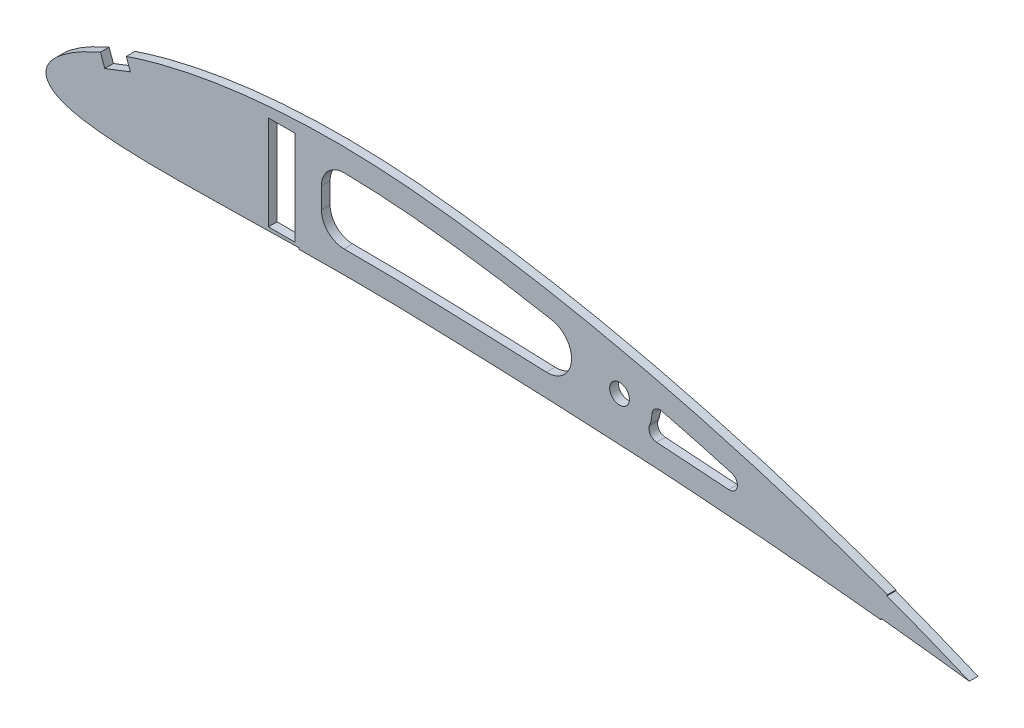
from build123d import *

# Parameters (mm, degrees)
SKETCH1_R           = 3.8862
SKETCH1_W           = 10.414
SKETCH1_H           = 37.132967143
BOSS_EXTRUDE1_DEPTH = 3.4036


with BuildPart() as part:
    # Sketch1 → Boss-Extrude1 (new body)
    with BuildSketch(Plane.XY):
        with BuildLine():
            Line((2548.863805049, 3240.993010404), (2548.870346536, 3240.472643256))
            add(Edge.make_bspline(
                [(2548.870346536, 3240.472643256), (2549.880763048, 3240.485345106), (2552.565327641, 3240.520575205), (2556.947797606, 3240.581451281), (2562.030529235, 3240.583201978), (2567.173828356, 3240.598367485), (2572.377983544, 3240.614063866), (2577.654631688, 3240.581828802), (2582.978163683, 3240.486914125), (2588.350084988, 3240.44098722), (2593.779620592, 3240.256138586), (2599.307416132, 3240.102047018), (2604.908682597, 3239.92347645), (2610.572157053, 3239.771360292), (2616.257225785, 3239.526848933), (2621.969941233, 3239.381379235), (2627.679751972, 3239.150520279), (2633.40209681, 3238.938457036), (2639.136822152, 3238.734443989), (2644.868715349, 3238.4699587), (2650.588345306, 3238.217674209), (2656.296308508, 3237.985536992), (2661.987661359, 3237.664189993), (2667.671808974, 3237.460504991), (2673.311212153, 3237.107925722), (2678.915236244, 3236.799838101), (2684.481545426, 3236.480361793), (2690.011544993, 3236.177968608), (2695.489391996, 3235.832495133), (2700.902150582, 3235.443952361), (2706.254125464, 3235.072976456), (2711.544005033, 3234.699956373), (2716.748448208, 3234.345063592), (2721.876237554, 3233.954236472), (2726.912041029, 3233.50052453), (2731.881695192, 3233.146418869), (2736.757779223, 3232.709631215), (2741.539063821, 3232.320452483), (2746.215557291, 3231.866388618), (2750.770763986, 3231.44101053), (2755.214578157, 3231.018598468), (2759.534567055, 3230.599989202), (2763.74642736, 3230.213242009), (2767.826055945, 3229.747599527), (2771.793322217, 3229.393530966), (2775.151456937, 3228.997383641), (2777.200029602, 3228.800463034), (2777.967751396, 3228.724927698)],
                knots=[19.396955855, 19.396955855, 19.396955855, 19.396955855, 19.516306022, 19.714059236, 19.914611374, 20.116619667, 20.321540433, 20.529276424, 20.739840618, 20.950404813, 21.163744737, 21.381461041, 21.603553869, 21.825646696, 22.050605171, 22.275615756, 22.500574231, 22.725532706, 22.951950418, 23.17832576, 23.403241591, 23.628157423, 23.853040081, 24.076496408, 24.299895492, 24.520374829, 24.739394295, 24.958413761, 25.174498693, 25.387658693, 25.599358693, 25.808138693, 26.013998693, 26.215483983, 26.415525295, 26.611170743, 26.803912863, 26.993735323, 27.177747459, 27.358840435, 27.534095176, 27.704971321, 27.871468943, 28.033634134, 28.189915523, 28.34186779, 28.432980691, 28.432980691, 28.432980691, 28.432980691], degree=3))
            Line((2777.967751396, 3228.724927698), (2778.019298543, 3229.248839689))
            add(Edge.make_bspline(
                [(2778.019298543, 3229.248839689), (2779.174843082, 3229.121826377), (2780.33031454, 3228.992340847), (2787.996855373, 3228.114715942), (2794.540348084, 3227.405765423), (2804.935623835, 3226.12645458), (2808.829276968, 3225.606545428), (2812.811153408, 3225.153500574)],
                knots=[28.432746502, 28.432746502, 28.432746502, 28.432746502, 28.569989508, 28.569989508, 29.343340852, 29.343340852, 29.81381441, 29.81381441, 29.81381441, 29.81381441], degree=3))
            add(Edge.make_bspline(
                [(2812.811153408, 3225.153500574), (2811.742721472, 3225.600441661), (2810.661000778, 3226.045928682), (2805.162016263, 3228.326768826), (2800.746808293, 3230.114518373), (2791.811027497, 3233.735759932), (2787.390855916, 3235.431304752), (2782.055306735, 3237.40976252), (2781.210779035, 3237.723256876), (2780.366179259, 3238.036483025)],
                knots=[0.240373092, 0.240373092, 0.240373092, 0.240373092, 0.376824745, 0.376824745, 0.94322841, 0.94322841, 1.509632074, 1.509632074, 1.616176715, 1.616176715, 1.616176715, 1.616176715], degree=3))
            Line((2780.366179259, 3238.036483025), (2780.542721306, 3238.509888009))
            add(Edge.make_bspline(
                [(2780.542721306, 3238.509888009), (2778.253003884, 3239.363847847), (2775.973270324, 3240.233125264), (2770.710976163, 3242.116135153), (2767.725148574, 3243.168246958), (2758.74878465, 3246.357401003), (2752.683897055, 3248.34483437), (2740.538782356, 3252.26222396), (2734.455623746, 3254.183226005), (2722.213291435, 3257.784641629), (2716.066133272, 3259.502671593), (2703.759263569, 3262.900392104), (2697.566087725, 3264.440009256), (2685.19779855, 3267.561634631), (2678.980101102, 3268.945637972), (2659.245529682, 3273.285820582), (2645.743376571, 3275.859564386), (2623.385680039, 3279.409222482), (2614.720124909, 3280.632934833), (2599.841966162, 3282.344537953), (2593.711900163, 3283.010221418), (2581.391632578, 3283.862976016), (2575.218869863, 3284.155891606), (2562.883619003, 3284.411814807), (2556.711751775, 3284.347450173), (2544.374681135, 3283.842287953), (2538.21354259, 3283.442427522), (2520.035165735, 3281.637660206), (2508.06427485, 3279.666633378), (2491.137898093, 3275.490419372), (2485.970358448, 3274.007797482), (2480.922843339, 3272.272034669)],
                knots=[1.615895701, 1.615895701, 1.615895701, 1.615895701, 1.904435817, 1.904435817, 2.27721661, 2.27721661, 3.031526478, 3.031526478, 3.785836345, 3.785836345, 4.540146213, 4.540146213, 5.29445608, 5.29445608, 6.048765948, 6.048765948, 7.680004166, 7.680004166, 8.718618602, 8.718618602, 9.449269441, 9.449269441, 10.17992028, 10.17992028, 10.910571118, 10.910571118, 11.641221957, 11.641221957, 13.074038532, 13.074038532, 13.708236999, 13.708236999, 13.708236999, 13.708236999], degree=3))
            Line((2480.922843339, 3272.272034669), (2482.522098625, 3267.78619144))
            Line((2482.522098625, 3267.78619144), (2472.446764627, 3263.900829171))
            Line((2472.446764627, 3263.900829171), (2470.766103702, 3268.615011763))
            add(Edge.make_bspline(
                [(2470.766103702, 3268.615011763), (2470.646363815, 3268.56292409), (2470.526712246, 3268.51063758), (2466.913650609, 3266.924530991), (2463.464058775, 3265.249121491), (2457.884399007, 3261.820409967), (2455.608911301, 3260.226987761), (2451.964070041, 3256.880119191), (2450.465728267, 3255.152258506), (2449.289153427, 3251.945522424), (2449.156845546, 3250.644636858), (2449.952027869, 3248.268878143), (2450.809883366, 3247.219654857), (2452.679965619, 3245.737281603), (2453.700996299, 3245.179722468), (2455.737837909, 3244.240621936), (2456.824400221, 3243.869914012), (2460.204069688, 3242.812239937), (2462.568258916, 3242.352246254), (2467.320698583, 3241.576679675), (2469.719825171, 3241.310902849), (2476.948343474, 3240.669412937), (2481.784959026, 3240.416065704), (2491.469537197, 3240.186039458), (2496.312043463, 3240.174782839), (2511.07935418, 3240.258746364), (2520.979134882, 3240.489134622), (2536.878421223, 3240.772637321), (2542.870480868, 3240.90742401), (2548.863805049, 3240.993010404)],
                knots=[14.135708649, 14.135708649, 14.135708649, 14.135708649, 14.151211266, 14.151211266, 14.60418364, 14.60418364, 14.932415743, 14.932415743, 15.199764537, 15.199764537, 15.36293217, 15.36293217, 15.526099802, 15.526099802, 15.662859963, 15.662859963, 15.799620124, 15.799620124, 16.08612483, 16.08612483, 16.372629537, 16.372629537, 16.94563895, 16.94563895, 17.518648363, 17.518648363, 18.689255122, 18.689255122, 19.396986742, 19.396986742, 19.396986742, 19.396986742], degree=3))
        make_face()
        with Locations((2675.105839614, 3254.346688729)):
            Circle(SKETCH1_R, mode=Mode.SUBTRACT)
        with Locations((2542.069305049, 3260.689793975)):
            Rectangle(SKETCH1_W, SKETCH1_H, mode=Mode.SUBTRACT)
        with BuildLine():
            Line((2557.75380505, 3266.542605367), (2557.753805049, 3258.378222418))
            ThreePointArc((2557.753805049, 3258.378222418), (2560.364468394, 3252.085207944), (2566.663148395, 3249.488243462))
            add(Edge.make_bspline(
                [(2566.663148395, 3249.488243462), (2567.439822141, 3249.489933395), (2568.21832178, 3249.491675794), (2573.587092614, 3249.504643302), (2578.32788588, 3249.449359207), (2585.825022944, 3249.347135077), (2589.036358319, 3249.304351405), (2595.165089719, 3249.113376562), (2598.167336091, 3249.027978689), (2604.257712531, 3248.841258324), (2607.248172017, 3248.763004856), (2612.867384093, 3248.574409602), (2615.291016485, 3248.466595568), (2620.124092488, 3248.315224279), (2622.661869101, 3248.243470439), (2627.621694753, 3248.054419578), (2630.051078266, 3247.958524901), (2637.052732353, 3247.701728241), (2641.706061455, 3247.508919449), (2646.263618968, 3247.307921056)],
                knots=[20.098452244, 20.098452244, 20.098452244, 20.098452244, 20.190362895, 20.190362895, 20.729094517, 20.729094517, 21.088163559, 21.088163559, 21.4472326, 21.4472326, 21.806301641, 21.806301641, 22.096767949, 22.096767949, 22.387234257, 22.387234257, 22.677700566, 22.677700566, 23.217183906, 23.217183906, 23.217183906, 23.217183906], degree=3))
            ThreePointArc((2646.263618968, 3247.307921056), (2656.146412526, 3255.739772924), (2648.426111877, 3266.187868076))
            add(Edge.make_bspline(
                [(2648.426111877, 3266.187868076), (2641.59243129, 3267.459725662), (2634.73375431, 3268.627915199), (2619.325224165, 3271.013148027), (2610.871110121, 3272.14615054), (2595.715687801, 3273.850412361), (2589.314555675, 3274.449261453), (2577.427735136, 3275.149902784), (2572.084779046, 3275.36120948), (2566.761726328, 3275.431823249)],
                knots=[6.961493486, 6.961493486, 6.961493486, 6.961493486, 7.79451578, 7.79451578, 8.825426338, 8.825426338, 9.617156173, 9.617156173, 10.265753337, 10.265753337, 10.265753337, 10.265753337], degree=3))
            ThreePointArc((2566.761726328, 3275.431823249), (2560.399456411, 3272.870338775), (2557.75380505, 3266.542605367))
        make_face(mode=Mode.SUBTRACT)
        with BuildLine():
            ThreePointArc((2686.916771023, 3249.475016973), (2687.580669946, 3251.588084984), (2687.869645343, 3253.784061172))
            ThreePointArc((2687.869645343, 3253.784061172), (2689.145550797, 3256.190957579), (2691.817251109, 3256.723031338))
            add(Edge.make_bspline(
                [(2719.203869949, 3249.372348083), (2714.238092072, 3250.792915022), (2709.231509514, 3252.195908246), (2700.184998092, 3254.612933038), (2696.020099344, 3255.664143956), (2691.817251109, 3256.723031338)],
                knots=[4.060379897, 4.060379897, 4.060379897, 4.060379897, 4.675695902, 4.675695902, 5.188469227, 5.188469227, 5.188469227, 5.188469227], degree=3))
            ThreePointArc((2719.203869949, 3249.372348083), (2721.456611216, 3245.76408158), (2718.098293363, 3243.153309361))
            add(Edge.make_bspline(
                [(2689.668722188, 3245.094651078), (2690.923606701, 3245.022133953), (2692.18303199, 3244.946990467), (2699.065872366, 3244.511400077), (2704.600706314, 3244.09912997), (2712.774522449, 3243.527064843), (2715.42427843, 3243.349505233), (2718.098293363, 3243.153309361)],
                knots=[24.923660459, 24.923660459, 24.923660459, 24.923660459, 25.070608892, 25.070608892, 25.727122197, 25.727122197, 26.039951507, 26.039951507, 26.039951507, 26.039951507], degree=3))
            ThreePointArc((2689.668722188, 3245.094651078), (2687.163429033, 3246.575343795), (2686.916771023, 3249.475016973))
        make_face(mode=Mode.SUBTRACT)
    extrude(amount=BOSS_EXTRUDE1_DEPTH)


solid = part.part
